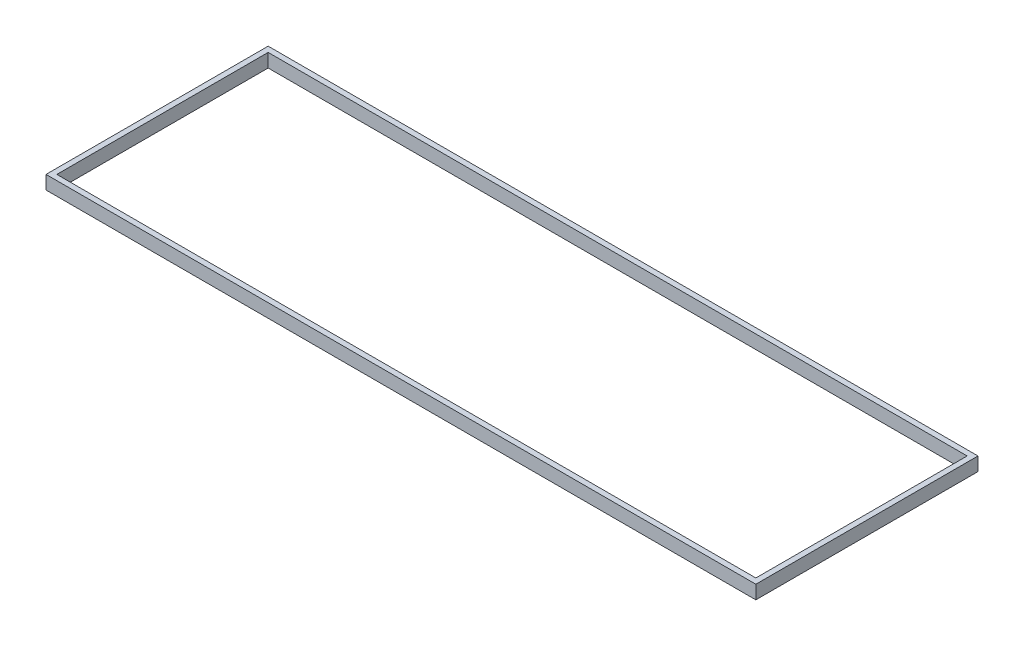
from build123d import *

# Parameters (mm, degrees)
SKETCH1_W           = 262
SKETCH1_H           = 82
SKETCH1_W_2         = 258
SKETCH1_H_2         = 78
BOSS_EXTRUDE1_DEPTH = 5


with BuildPart() as part:
    # Sketch1 → Boss-Extrude1 (new body)
    with BuildSketch(Plane(origin=(0, 0, 0), x_dir=(1, 0, 0), z_dir=(0, 1, 0))):
        with Locations((131, 41)):
            Rectangle(SKETCH1_W, SKETCH1_H)
        with Locations((131, 41)):
            Rectangle(SKETCH1_W_2, SKETCH1_H_2, mode=Mode.SUBTRACT)
    extrude(amount=BOSS_EXTRUDE1_DEPTH)


solid = part.part
